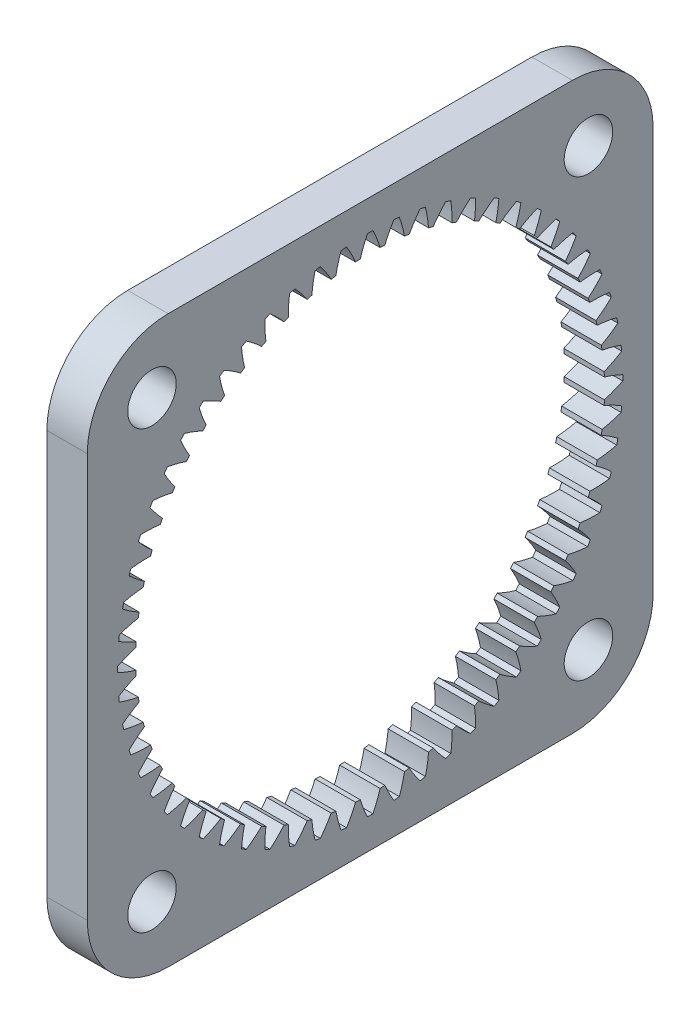
from build123d import *

# Parameters (mm, degrees)
BASPROSKE_W             = 5
BASPROSKE_H             = 6
TOOTHCUT_DEPTH          = 50.749371855
TEETHCUTS_COUNT         = 60
TEETHCUTS_ANGLE         = 354
SALIENTE_EXTRUIR3_DEPTH = 5
REDONDEO1_R             = 10
CROQUIS3_R              = 3
CORTAR_EXTRUIR2_DEPTH   = 10


with BuildPart() as part:
    # BasProSke → Base-Revolve (revolve)
    with BuildSketch(Plane(origin=(0, 0, 0), x_dir=(1, 0, 0), z_dir=(0, 1, 0)), mode=Mode.PRIVATE) as base_revolve_sk:
        with Locations((2.5, 32)):
            Rectangle(BASPROSKE_W, BASPROSKE_H)
    revolve(base_revolve_sk.sketch.rotate(Axis((-10, 0, 0), (1, 0, 0)), 180), axis=Axis((-10, 0, 0), (1, 0, 0)))

    # TooCutSke → ToothCut (cut, through all)
    with BuildSketch(Plane(origin=(0, 0, 0), x_dir=(0, 0, -1), z_dir=(1, 0, 0))):
        with BuildLine():
            ThreePointArc((1.227357706, 28.948593027), (0.830805794, 30.117149174), (0.339543276, 31.24915537))
            ThreePointArc((0.339543276, 31.24915537), (0, 31.251), (-0.339543276, 31.24915537))
            ThreePointArc((-0.339543276, 31.24915537), (-0.830805794, 30.117149174), (-1.227357706, 28.948593027))
            ThreePointArc((-1.227357706, 28.948593027), (0, 28.9746), (1.227357706, 28.948593027))
        make_face()
    toothcut = extrude(amount=TOOTHCUT_DEPTH, mode=Mode.SUBTRACT)

    # TeethCuts: ToothCut ×60 about axis
    teethcuts_axis = Axis((-10, 0, 0), (1, 0, 0))
    for i in range(1, TEETHCUTS_COUNT):
        add(toothcut.rotate(teethcuts_axis, i * TEETHCUTS_ANGLE / (TEETHCUTS_COUNT - 1)), mode=Mode.SUBTRACT)

    # Croquis2 → Saliente-Extruir3 (add, through all)
    with BuildSketch(Plane.ZY):
        with BuildLine():
            Line((-1.5e-08, 35), (-35, 35))
            Line((-35, 35), (-35, -1.47e-07))
            ThreePointArc((-35, -1.47e-07), (-24.748737399, 24.748737284), (-1.5e-08, 35))
        make_face()
        with BuildLine():
            Line((35, 35), (-1.5e-08, 35))
            ThreePointArc((-1.5e-08, 35), (24.748737336, 24.748737347), (35, 0))
            Line((35, 0), (35, 35))
        make_face()
        with BuildLine():
            Line((35, -35), (35, 0))
            ThreePointArc((35, 0), (24.748737349, -24.748737334), (2.1e-08, -35))
            Line((2.1e-08, -35), (35, -35))
        make_face()
        with BuildLine():
            ThreePointArc((2.1e-08, -35), (-24.748737282, -24.748737401), (-35, -1.47e-07))
            Line((-35, -1.47e-07), (-35, -35))
            Line((-35, -35), (2.1e-08, -35))
        make_face()
    extrude(amount=-SALIENTE_EXTRUIR3_DEPTH)

    # Redondeo1
    redondeo1_edges = [part.edges().sort_by_distance(p)[0] for p in [
        (2.5, 35, -35),
        (2.5, 35, 35),
        (2.5, -35, 35),
        (2.5, -35, -35),
    ]]
    fillet(redondeo1_edges, radius=REDONDEO1_R)

    # Croquis3 → Cortar-Extruir2 (cut)
    with BuildSketch(Plane(origin=(5, 0, 0), x_dir=(0, 0, -1), z_dir=(1, 0, 0))):
        with Locations((-27, 27)):
            Circle(CROQUIS3_R)
        with Locations((27, 27)):
            Circle(CROQUIS3_R)
        with Locations((27, -27)):
            Circle(CROQUIS3_R)
        with Locations((-27, -27)):
            Circle(CROQUIS3_R)
    extrude(amount=-CORTAR_EXTRUIR2_DEPTH, mode=Mode.SUBTRACT)


solid = part.part
